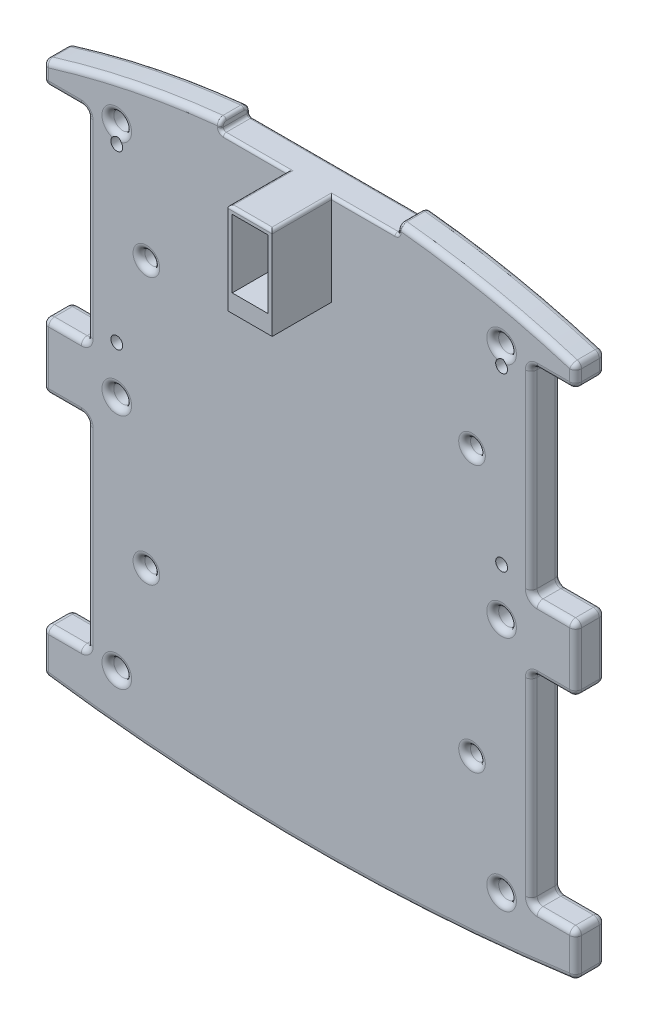
from build123d import *

# Parameters (mm, degrees)
SKETCH2_W                 = 180
SKETCH2_H                 = 180
BOSS_EXTRUDE1_DEPTH       = 10
SKETCH3_W                 = 15
SKETCH3_H                 = 68
CUT_EXTRUDE2_DEPTH        = 10
LPATTERN1_COUNT           = 2
LPATTERN1_PITCH           = 165
LPATTERN1_COUNT_DIR2      = 2
LPATTERN1_PITCH_DIR2      = 90
SKETCH4_R                 = 3
CUT_EXTRUDE4_DEPTH        = 10
LPATTERN2_COUNT           = 2
LPATTERN2_PITCH           = 80
LPATTERN2_COUNT_DIR2      = 2
LPATTERN2_PITCH_DIR2      = 130
LPATTERN3_COUNT           = 2
LPATTERN3_PITCH           = 80
LPATTERN3_COPY_1_SKETCH_R = 3
LPATTERN3_COPY_1_DEPTH    = 10
LPATTERN3_COPY_2_SKETCH_R = 3
LPATTERN3_COPY_2_DEPTH    = 10
LPATTERN3_COPY_3_SKETCH_R = 3
LPATTERN3_COPY_3_DEPTH    = 10
SKETCH5_R                 = 2.5
CUT_EXTRUDE5_DEPTH        = 10
LPATTERN4_COUNT           = 2
LPATTERN4_PITCH           = 90
LPATTERN4_COUNT_DIR2      = 2
LPATTERN4_PITCH_DIR2      = 110
FILLET1_R                 = 2
SKETCH10_W                = 15
SKETCH10_H                = 35
SKETCH10_W_2              = 12
SKETCH10_H_2              = 23
BOSS_EXTRUDE2_DEPTH       = 30
SKETCH13_W                = 12
SKETCH13_H                = 23
CUT_EXTRUDE6_DEPTH        = 137.014705176
SKETCH16_W                = 60
SKETCH16_H                = 5
CUT_EXTRUDE8_DEPTH        = 138.840487615
FILLET2_R                 = 1
SKETCH19_R                = 2
CUT_EXTRUDE11_DEPTH       = 138.840487593
LPATTERN5_COUNT           = 2
LPATTERN5_PITCH           = 58
LPATTERN5_COUNT_DIR2      = 2
LPATTERN5_PITCH_DIR2      = 130


with BuildPart() as part:
    # Sketch2 → Boss-Extrude1 (new body)
    with BuildSketch(Plane.XY):
        with Locations((0, -3.730444936)):
            Rectangle(SKETCH2_W, SKETCH2_H)
        with BuildLine():
            ThreePointArc((-90, 86.269555064), (0, 100), (90, 86.269555064))
            Line((90, 86.269555064), (-90, 86.269555064))
        make_face()
        with BuildLine():
            ThreePointArc((90, -93.730444936), (0, -100), (-90, -93.730444936))
            Line((-90, -93.730444936), (90, -93.730444936))
        make_face()
    extrude(amount=BOSS_EXTRUDE1_DEPTH)

    # Sketch3 → Cut-Extrude2 (cut)
    with BuildSketch(Plane.XY):
        with Locations((82.5, 45)):
            Rectangle(SKETCH3_W, SKETCH3_H)
    cut_extrude2 = extrude(amount=CUT_EXTRUDE2_DEPTH, mode=Mode.SUBTRACT)

    # LPattern1: Cut-Extrude2 2 × 2
    with Locations(*[(-i * LPATTERN1_PITCH, -j * LPATTERN1_PITCH_DIR2, 0) for i in range(LPATTERN1_COUNT) for j in range(LPATTERN1_COUNT_DIR2) if (i, j) != (0, 0)]):
        add(cut_extrude2, mode=Mode.SUBTRACT)

    # Sketch4 → Cut-Extrude4 (cut)
    with BuildSketch(Plane.XY):
        with Locations((-65, 0)):
            Circle(SKETCH4_R)
    cut_extrude4 = extrude(amount=CUT_EXTRUDE4_DEPTH, mode=Mode.SUBTRACT)

    # LPattern2: Cut-Extrude4 2 × 2
    with Locations(*[(j * LPATTERN2_PITCH_DIR2, i * LPATTERN2_PITCH, 0) for i in range(LPATTERN2_COUNT) for j in range(LPATTERN2_COUNT_DIR2) if (i, j) != (0, 0)]):
        add(cut_extrude4, mode=Mode.SUBTRACT)

    # LPattern3: Cut-Extrude4 ×2
    with Locations(*[(0, -i * LPATTERN3_PITCH, 0) for i in range(1, LPATTERN3_COUNT)]):
        add(cut_extrude4, mode=Mode.SUBTRACT)

    # LPattern3 copy 1 sketch → LPattern3 copy 1 (cut)
    with BuildSketch(Plane(origin=(130, -80, 0), x_dir=(1, 0, 0), z_dir=(0, 0, 1))):
        with Locations((-65, 0)):
            Circle(LPATTERN3_COPY_1_SKETCH_R)
    extrude(amount=LPATTERN3_COPY_1_DEPTH, mode=Mode.SUBTRACT)

    # LPattern3 copy 2 sketch → LPattern3 copy 2 (cut)
    with BuildSketch(Plane.XY):
        with Locations((-65, 0)):
            Circle(LPATTERN3_COPY_2_SKETCH_R)
    extrude(amount=LPATTERN3_COPY_2_DEPTH, mode=Mode.SUBTRACT)

    # LPattern3 copy 3 sketch → LPattern3 copy 3 (cut)
    with BuildSketch(Plane(origin=(130, 0, 0), x_dir=(1, 0, 0), z_dir=(0, 0, 1))):
        with Locations((-65, 0)):
            Circle(LPATTERN3_COPY_3_SKETCH_R)
    extrude(amount=LPATTERN3_COPY_3_DEPTH, mode=Mode.SUBTRACT)

    # Sketch5 → Cut-Extrude5 (cut)
    with BuildSketch(Plane.XY):
        with Locations((-55, 44.986499289)):
            Circle(SKETCH5_R)
    cut_extrude5 = extrude(amount=CUT_EXTRUDE5_DEPTH, mode=Mode.SUBTRACT)

    # LPattern4: Cut-Extrude5 2 × 2
    with Locations(*[(j * LPATTERN4_PITCH_DIR2, -i * LPATTERN4_PITCH, 0) for i in range(LPATTERN4_COUNT) for j in range(LPATTERN4_COUNT_DIR2) if (i, j) != (0, 0)]):
        add(cut_extrude5, mode=Mode.SUBTRACT)

    # Fillet1
    fillet1_edges = [part.edges().sort_by_distance(p)[0] for p in [
        (0, 100, 10),
        (-68, -80, 0),
        (-68, -80, 10),
        (-57.5, 44.986499289, 0),
        (-57.5, 44.986499289, 10),
        (-57.5, -45.013500711, 10),
        (-57.5, -45.013500711, 0),
        (52.5, 44.986499289, 10),
        (52.5, 44.986499289, 0),
        (52.5, -45.013500711, 10),
        (52.5, -45.013500711, 0),
        (-90, 82.634777532, 10),
        (90, 0, 0),
        (90, 0, 10),
        (0, -100, 10),
        (90, 11, 5),
        (82.5, 79, 0),
        (90, 79, 5),
        (75, 45, 0),
        (75, 79, 5),
        (82.5, 11, 0),
        (75, 11, 5),
        (82.5, 79, 10),
        (75, 45, 10),
        (82.5, 11, 10),
        (-90, 0, 0),
        (-90, -86.365222468, 0),
        (-90, 0, 10),
        (-90, -86.365222468, 10),
        (90, -86.365222468, 0),
        (90, -86.365222468, 10),
        (90, -79, 5),
        (82.5, -11, 0),
        (90, -11, 5),
        (75, -45, 0),
        (90, 82.634777532, 10),
        (75, -11, 5),
        (82.5, -79, 0),
        (75, -79, 5),
        (82.5, -11, 10),
        (75, -45, 10),
        (82.5, -79, 10),
        (-75, 45, 0),
        (-75, 11, 5),
        (-82.5, 79, 0),
        (-75, 79, 5),
        (-90, 79, 5),
        (0, -100, 0),
        (-82.5, 11, 0),
        (-90, 11, 5),
        (-75, 45, 10),
        (-82.5, 79, 10),
        (-82.5, 11, 10),
        (-75, -45, 0),
        (-90, 82.634777532, 0),
        (-75, -79, 5),
        (-82.5, -11, 0),
        (-75, -11, 5),
        (-90, -11, 5),
        (-82.5, -79, 0),
        (-90, -79, 5),
        (-75, -45, 10),
        (-82.5, -11, 10),
        (-82.5, -79, 10),
        (0, 100, 0),
        (90, 82.634777532, 0),
        (-68, 0, 0),
        (-68, 0, 10),
        (-68, 80, 10),
        (-68, 80, 0),
        (62, 0, 10),
        (90, -93.730444936, 5),
        (62, 0, 0),
        (-90, -93.730444936, 5),
        (62, 80, 10),
        (-90, 86.269555064, 5),
        (62, 80, 0),
        (90, 86.269555064, 5),
        (62, -80, 0),
        (62, -80, 10),
    ]]
    fillet(fillet1_edges, radius=FILLET1_R)

    # Sketch10 → Boss-Extrude2 (add)
    with BuildSketch(Plane(origin=(0, 0, 0), x_dir=(-1, 0, 0), z_dir=(0, 0, -1))):
        with Locations((0, 81.5)):
            Rectangle(SKETCH10_W, SKETCH10_H)
        with Locations((0, 81.5)):
            Rectangle(SKETCH10_W_2, SKETCH10_H_2, mode=Mode.SUBTRACT)
    extrude(amount=-BOSS_EXTRUDE2_DEPTH)

    # Sketch13 → Cut-Extrude6 (cut, through all)
    with BuildSketch(Plane.XY.offset(10)):
        with Locations((0, 81.5)):
            Rectangle(SKETCH13_W, SKETCH13_H)
    extrude(amount=-CUT_EXTRUDE6_DEPTH, mode=Mode.SUBTRACT)

    # Sketch16 → Cut-Extrude8 (cut, through all)
    with BuildSketch(Plane(origin=(0, 0, 0), x_dir=(-1, 0, 0), z_dir=(0, 0, -1))):
        with Locations((0, 97.5)):
            Rectangle(SKETCH16_W, SKETCH16_H)
    extrude(amount=-CUT_EXTRUDE8_DEPTH, mode=Mode.SUBTRACT)

    # Fillet2
    fillet2_edges = [part.edges().sort_by_distance(p)[0] for p in [
        (0, 95, 30),
        (30, 97.914903555, 0.584013498),
        (-30, 97.914903555, 0.584013498),
        (-30, 97.914903555, 9.415986502),
        (-30, 95.747687541, 10),
        (-30, 98.505394875, 4.9999997),
        (30, 95.747687541, 10),
        (30, 97.914903555, 9.415986502),
        (30, 98.505394875, 4.9999997),
        (-18.75, 95, 10),
        (-7.5, 95, 20),
        (7.5, 95, 20),
        (18.75, 95, 10),
        (-30, 95, 5),
        (30, 95, 5),
        (30, 95.747687541, 0),
        (0, 95, 0),
        (-30, 95.747687541, 0),
    ]]
    fillet(fillet2_edges, radius=FILLET2_R)

    # Sketch19 → Cut-Extrude11 (cut, through all)
    with BuildSketch(Plane.XY):
        with Locations((-65, 16)):
            Circle(SKETCH19_R)
    cut_extrude11 = extrude(amount=CUT_EXTRUDE11_DEPTH, mode=Mode.SUBTRACT)

    # LPattern5: Cut-Extrude11 2 × 2
    with Locations(*[(j * LPATTERN5_PITCH_DIR2, i * LPATTERN5_PITCH, 0) for i in range(LPATTERN5_COUNT) for j in range(LPATTERN5_COUNT_DIR2) if (i, j) != (0, 0)]):
        add(cut_extrude11, mode=Mode.SUBTRACT)


solid = part.part
